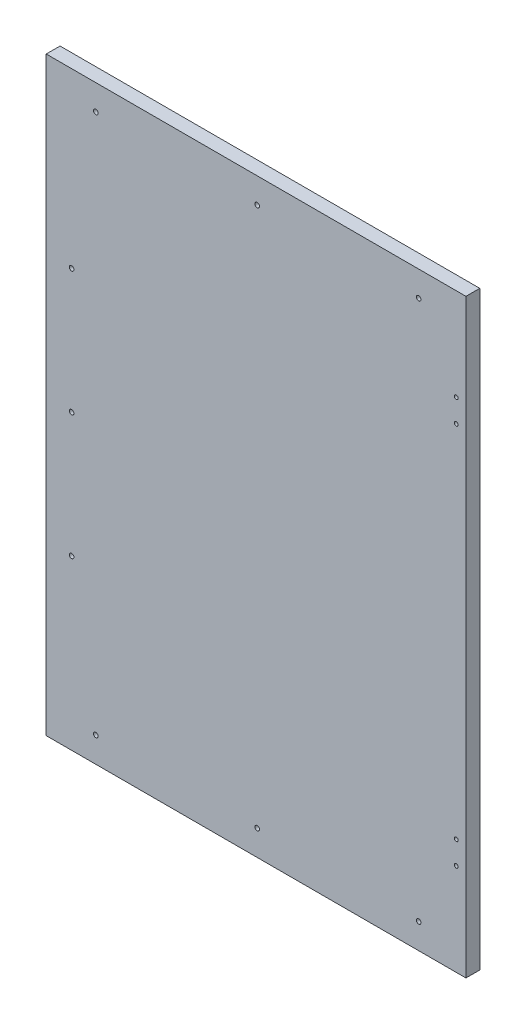
from build123d import *

# Parameters (mm, degrees)
SKETCH_1_W               = 455
SKETCH_1_H               = 640
EXTRUDE_1_DEPTH          = 15
CUT_EXTRUDE_1_DEPTH      = 393.913794617
CUT_EXTRUDE_1_DEPTH_BACK = 393.913794617
SKETCH_2_R               = 2.5
SKETCH_2_3_R             = 2.5
CUT_EXTRUDE_2_DEPTH      = 393.913794617
SKETCH_3_R               = 2.1
CUT_EXTRUDE_3_DEPTH      = 393.913794617


with BuildPart() as part:
    # ｽｹｯﾁ1 → ﾎﾞｽ - 押し出し1 (new body)
    with BuildSketch(Plane.XY):
        Rectangle(SKETCH_1_W, SKETCH_1_H)
    extrude(amount=EXTRUDE_1_DEPTH)

    # ｽｹｯﾁ2 → ｶｯﾄ - 押し出し1 (cut, two sides: drawn at the far end of the back side and taken through both)
    with BuildSketch(Plane.XY.offset(15).offset(-CUT_EXTRUDE_1_DEPTH_BACK)):
        with Locations((-200, 132.5)):
            Circle(SKETCH_2_R)
        with Locations((-200, -2.5)):
            Circle(SKETCH_2_R)
        with Locations((-200, -137.5)):
            Circle(SKETCH_2_R)
    extrude(amount=CUT_EXTRUDE_1_DEPTH + CUT_EXTRUDE_1_DEPTH_BACK, mode=Mode.SUBTRACT)

    # ｽｹｯﾁ2<3> → ｶｯﾄ - 押し出し2 (cut, through all)
    with BuildSketch(Plane.XY.offset(15)):
        with Locations((1.25, 292.5)):
            Circle(SKETCH_2_3_R)
        with Locations((-173.75, 292.5)):
            Circle(SKETCH_2_3_R)
        with Locations((176.25, 292.5)):
            Circle(SKETCH_2_3_R)
    cut_extrude_2 = extrude(amount=-CUT_EXTRUDE_2_DEPTH, mode=Mode.SUBTRACT)

    # ﾐﾗｰ1: ｶｯﾄ - 押し出し2 across plane
    add(cut_extrude_2.mirror(Plane.ZX), mode=Mode.SUBTRACT)

    # ｽｹｯﾁ3 → ｶｯﾄ - 押し出し3 (cut, through all)
    with BuildSketch(Plane.XY.offset(15)):
        with Locations((217, -220)):
            Circle(SKETCH_3_R)
        with Locations((217, -195)):
            Circle(SKETCH_3_R)
    cut_extrude_3 = extrude(amount=-CUT_EXTRUDE_3_DEPTH, mode=Mode.SUBTRACT)

    # ﾐﾗｰ2: ｶｯﾄ - 押し出し3 across plane
    add(cut_extrude_3.mirror(Plane.ZX), mode=Mode.SUBTRACT)


solid = part.part
